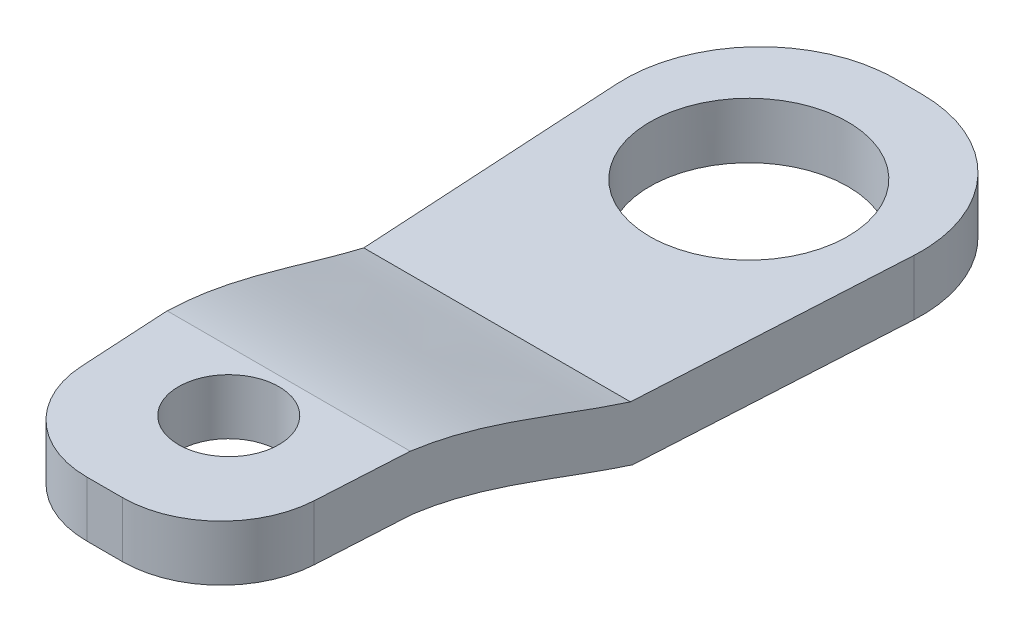
from build123d import *

# Parameters (mm, degrees)
SKETCH1_R                = 8.022684963
SKETCH1_R_2              = 4.06906829
BOSS_EXTRUDE1_DEPTH      = 9
CUT_EXTRUDE2_DEPTH       = 80
CUT_EXTRUDE2_DEPTH_BACK  = 80
CUT_EXTRUDE15_DEPTH      = 68.428154516
CUT_EXTRUDE15_DEPTH_BACK = 68.428154516


with BuildPart() as part:
    # Sketch1 → Boss-Extrude1 (new body)
    with BuildSketch(Plane(origin=(0, 0, 0), x_dir=(1, 0, 0), z_dir=(0, 1, 0))):
        with BuildLine():
            Line((-2.221076805, 65.28335408), (-1.171915361, 65.28335408))
            ThreePointArc((-1.171915361, 65.28335408), (6.823214902, 61.838345283), (9.810473513, 53.661152641))
            Line((9.810473513, 53.661152641), (7.206522245, 7.699180155))
            ThreePointArc((7.206522245, 7.699180155), (4.713869394, 2.337050101), (-0.780669663, 0.151690292))
            Line((-0.780669663, 0.151690292), (-2.221076805, 0.151690292))
            Line((-2.221076805, 0.151690292), (-3.661483948, 0.151690292))
            ThreePointArc((-3.661483948, 0.151690292), (-9.156023005, 2.337050101), (-11.648675856, 7.699180155))
            Line((-11.648675856, 7.699180155), (-14.252627123, 53.661152641))
            ThreePointArc((-14.252627123, 53.661152641), (-11.265368512, 61.838345283), (-3.27023825, 65.28335408))
            Line((-3.27023825, 65.28335408), (-2.221076805, 65.28335408))
        make_face()
        with Locations((-2.221076805, 52.32335408)):
            Circle(SKETCH1_R, mode=Mode.SUBTRACT)
        with Locations((-2.221076805, 10.201686469)):
            Circle(SKETCH1_R_2, mode=Mode.SUBTRACT)
    extrude(amount=BOSS_EXTRUDE1_DEPTH)

    # Sketch2 → Cut-Extrude2 (cut, two sides: drawn at the far end of the back side and taken through both)
    with BuildSketch(Plane(origin=(0, 0, 0), x_dir=(0, 0, -1), z_dir=(1, 0, 0)).offset(-CUT_EXTRUDE2_DEPTH_BACK)):
        with BuildLine():
            Line((7.699180155, 4.5), (0.151690292, 4.5))
            Line((0.151690292, 4.5), (0.151690292, 0))
            Line((0.151690292, 0), (32.11164194, 0))
            add(Edge.make_bspline(
                [(15.233518693, 4.5), (20.997577491, 4.003468068), (26.535168731, 1.567737081), (32.11164194, 0)],
                knots=[0.310739068, 0.310739068, 0.310739068, 0.310739068, 1, 1, 1, 1], degree=3))
            Line((15.233518693, 4.5), (7.699180155, 4.5))
        make_face()
    extrude(amount=CUT_EXTRUDE2_DEPTH + CUT_EXTRUDE2_DEPTH_BACK, mode=Mode.SUBTRACT)

    # Sketch3 → Cut-Extrude15 (cut, two sides: drawn at the far end of the back side and taken through both)
    with BuildSketch(Plane(origin=(0, 0, 0), x_dir=(0, 0, -1), z_dir=(1, 0, 0)).offset(-CUT_EXTRUDE15_DEPTH_BACK)):
        with BuildLine():
            Line((65.441158073, 9.059719613), (65.441158073, 9.358577967))
            Line((65.441158073, 9.358577967), (15.059583295, 9.985835555))
            Line((15.059583295, 9.985835555), (14.793593064, 9.985835555))
            Line((14.793593064, 9.985835555), (0, 9.985835555))
            Line((0, 9.985835555), (0, 8.994860535))
            Line((0, 8.994860535), (15.059583295, 8.994860535))
            add(Edge.make_bspline(
                [(15.059583295, 8.994860535), (20.823642093, 8.498328604), (26.361233333, 6.062597616), (31.937706542, 4.494860535)],
                knots=[0.310739068, 0.310739068, 0.310739068, 0.310739068, 1, 1, 1, 1], degree=3))
            Line((31.937706542, 4.494860535), (65.441158073, 4.533727355))
            Line((65.441158073, 4.533727355), (65.441158073, 9.059719613))
        make_face()
    extrude(amount=CUT_EXTRUDE15_DEPTH + CUT_EXTRUDE15_DEPTH_BACK, mode=Mode.SUBTRACT)


solid = part.part
